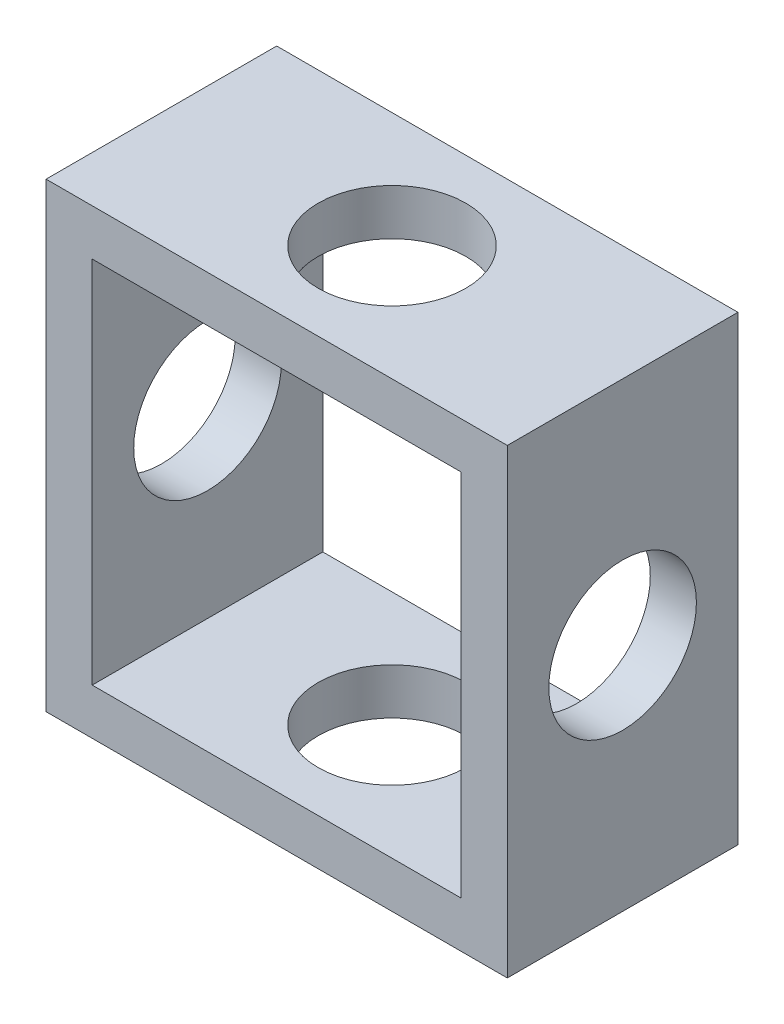
from build123d import *

# Parameters (mm, degrees)
CROQUIS1_W              = 50
CROQUIS1_H              = 50
CROQUIS1_W_2            = 40
CROQUIS1_H_2            = 40
SALIENTE_EXTRUIR1_DEPTH = 25
CROQUIS2_R              = 8
CORTAR_EXTRUIR1_DEPTH   = 60
CROQUIS3_R              = 8
CORTAR_EXTRUIR2_DEPTH   = 60


with BuildPart() as part:
    # Croquis1 → Saliente-Extruir1 (new body)
    with BuildSketch(Plane.XY):
        Rectangle(CROQUIS1_W, CROQUIS1_H)
        Rectangle(CROQUIS1_W_2, CROQUIS1_H_2, mode=Mode.SUBTRACT)
    extrude(amount=SALIENTE_EXTRUIR1_DEPTH)

    # Croquis2 → Cortar-Extruir1 (cut)
    with BuildSketch(Plane(origin=(0, 25, 0), x_dir=(1, 0, 0), z_dir=(0, 1, 0))):
        with Locations(Location((0, -12.5, 0), (0, 0, 270))):
            Circle(CROQUIS2_R)
    extrude(amount=-CORTAR_EXTRUIR1_DEPTH, mode=Mode.SUBTRACT)

    # Croquis3 → Cortar-Extruir2 (cut)
    with BuildSketch(Plane(origin=(25, 0, 0), x_dir=(0, 0, -1), z_dir=(1, 0, 0))):
        with Locations(Location((-12.5, 0, 0), (0, 0, 90))):
            Circle(CROQUIS3_R)
    extrude(amount=-CORTAR_EXTRUIR2_DEPTH, mode=Mode.SUBTRACT)


solid = part.part
